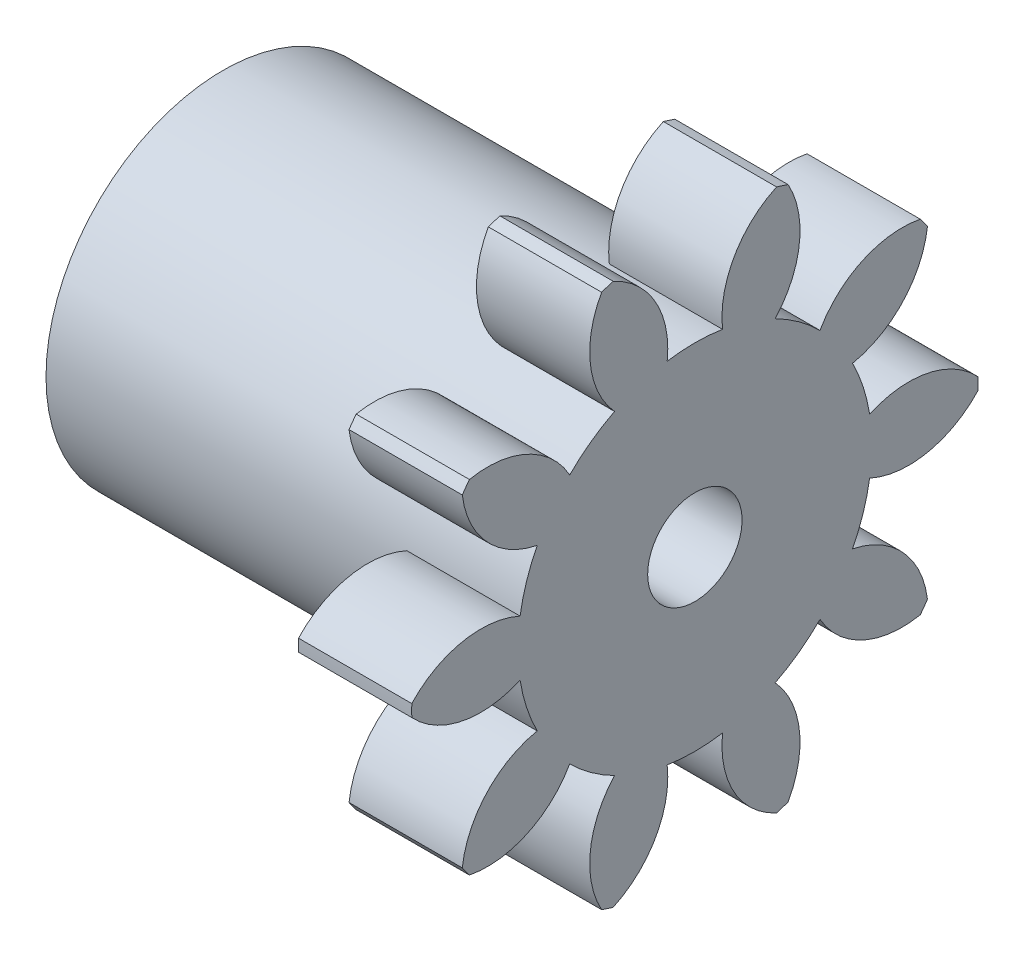
from build123d import *
from build123d.topology import SkipClean

# Parameters (mm, degrees)
BASPROSKE_W      = 12
BASPROSKE_H      = 30
TOOTHCUT_DEPTH   = 45.09081537
TEETHCUTS_COUNT  = 10
TEETHCUTS_ANGLE  = 324
HUBNEARONE_START = 38.0000508
HUBNEAONESKE_R   = 18.749
HUBNEARONE_DEPTH = 38.0000508
BORSKE_R         = 5
BORE_DEPTH       = 50.0000508


with BuildPart() as part:
    # BasProSke → Base-Revolve (revolve)
    with BuildSketch(Plane(origin=(0, 0, 0), x_dir=(1, 0, 0), z_dir=(0, 1, 0)), mode=Mode.PRIVATE) as base_revolve_sk:
        with Locations((6, 15)):
            Rectangle(BASPROSKE_W, BASPROSKE_H)
    revolve(base_revolve_sk.sketch.rotate(Axis((-10, 0, 0), (1, 0, 0)), 180), axis=Axis((-10, 0, 0), (1, 0, 0)))

    # TooCutSke → ToothCut (cut, through all)
    with BuildSketch(Plane(origin=(0, 0, 0), x_dir=(0, 0, -1), z_dir=(1, 0, 0))):
        with BuildLine():
            ThreePointArc((2.93332476, 18.51811564), (0, 18.749), (-2.93332476, 18.51811564))
            ThreePointArc((-2.93332476, 18.51811564), (-4.155816835, 24.562157762), (-8.691330358, 28.739962104))
            ThreePointArc((-8.691330358, 28.739962104), (0, 30.0254), (8.691330358, 28.739962104))
            ThreePointArc((8.691330358, 28.739962104), (4.155816835, 24.562157762), (2.93332476, 18.51811564))
        make_face()
    toothcut = extrude(amount=TOOTHCUT_DEPTH, mode=Mode.SUBTRACT)

    # TeethCuts: ToothCut ×10 about axis
    teethcuts_axis = Axis((-10, 0, 0), (1, 0, 0))
    for i in range(1, TEETHCUTS_COUNT):
        add(toothcut.rotate(teethcuts_axis, i * TEETHCUTS_ANGLE / (TEETHCUTS_COUNT - 1)), mode=Mode.SUBTRACT)

    # HubNeaOneSke → HubNearOne (add)
    with SkipClean():  # the faces are left unmerged after this step: merging them gives an invalid solid
        with BuildSketch(Plane.ZY.offset(HUBNEARONE_START)):
            Circle(HUBNEAONESKE_R)
        extrude(amount=-HUBNEARONE_DEPTH)

    # BorSke → Bore (cut, symmetric)
    with SkipClean():  # the faces are left unmerged after this step: merging them gives an invalid solid
        with BuildSketch(Plane(origin=(0, 0, 0), x_dir=(0, 0, -1), z_dir=(1, 0, 0))):
            with Locations(Location((0, 0, 0), (0, 0, 180))):
                Circle(BORSKE_R)
        extrude(amount=BORE_DEPTH, both=True, mode=Mode.SUBTRACT)


solid = part.part
